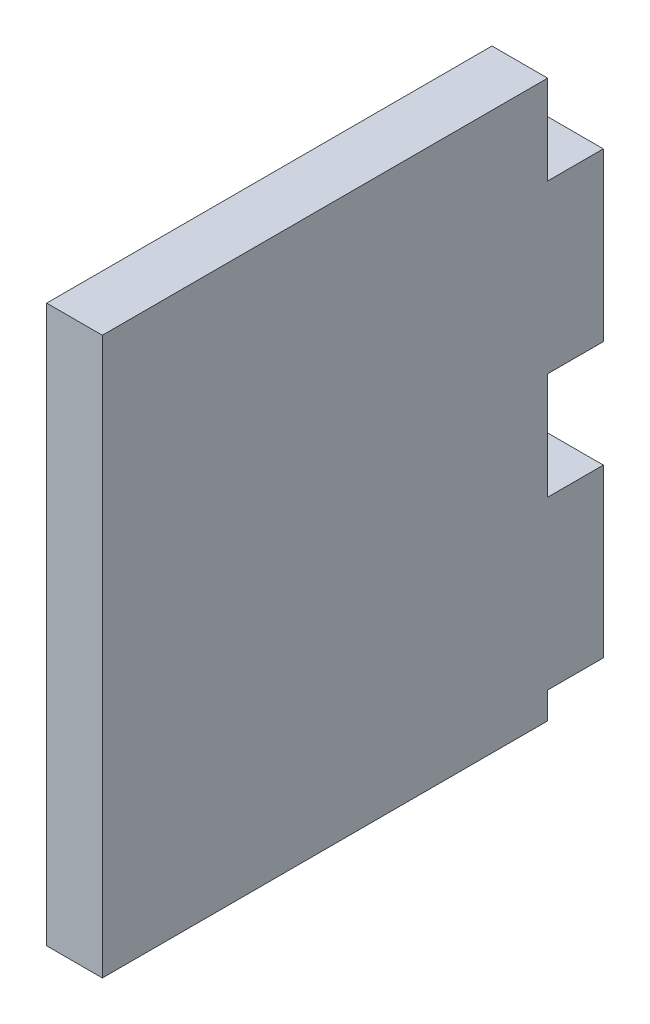
from build123d import *

# Parameters (mm, degrees)
SKETCH_1_W      = 40
SKETCH_1_H      = 50
SKETCH_1_W_2    = 5
SKETCH_1_H_2    = 15
EXTRUDE_1_DEPTH = 5


with BuildPart() as part:
    # 草图1 → 凸台-拉伸1 (new body)
    with BuildSketch(Plane(origin=(0, 0, 0), x_dir=(0, 0, -1), z_dir=(1, 0, 0))):
        with Locations((20, -25)):
            Rectangle(SKETCH_1_W, SKETCH_1_H)
        with Locations((42.5, -15.5)):
            Rectangle(SKETCH_1_W_2, SKETCH_1_H_2)
        with Locations((42.5, -40.1)):
            Rectangle(SKETCH_1_W_2, SKETCH_1_H_2)
    extrude(amount=EXTRUDE_1_DEPTH)


solid = part.part
